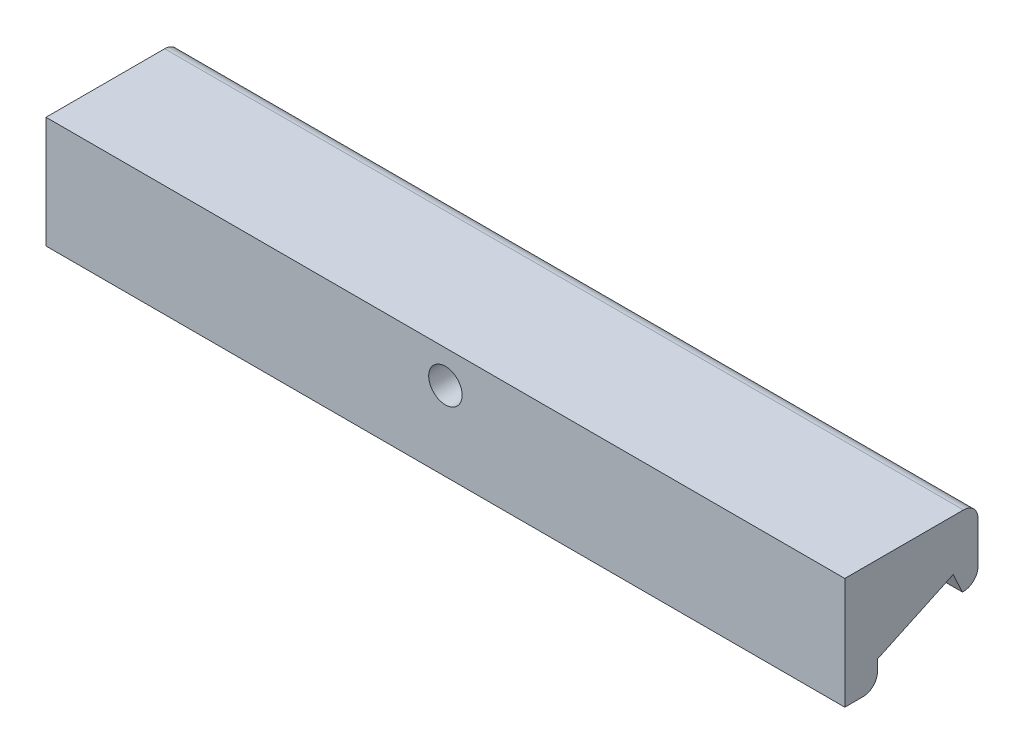
from build123d import *

# Parameters (mm, degrees)
PROFILEBOSS_EXTRUDE1_DEPTH      = 110
SKETCH3_R                       = 2.3
MOUNTINGHOLESCUT_EXTRUDE3_DEPTH = 4.5


with BuildPart() as part:
    # Sketch1 → ProfileBoss-Extrude1 (new body)
    with BuildSketch(Plane(origin=(0, 0, 0), x_dir=(0, 0, -1), z_dir=(1, 0, 0))):
        with BuildLine():
            Line((0, 0), (2.499461553, 0))
            ThreePointArc((2.499461553, 0), (3.914055855, 0.585944145), (4.5, 2.000538447))
            Line((4.5, 2.000538447), (4.5, 3.5))
            Line((4.5, 3.5), (14.922539551, 8.36011001))
            Line((14.922539551, 8.36011001), (16.190394336, 5.641186649))
            ThreePointArc((16.190394336, 5.641186649), (17.700753359, 6.16912635), (18.340729536, 7.635528477))
            Line((18.340729536, 7.635528477), (18.340729536, 13.36011001))
            ThreePointArc((18.340729536, 13.36011001), (17.754943098, 14.774323572), (16.340729536, 15.36011001))
            Line((16.340729536, 15.36011001), (0, 15.36011001))
            Line((0, 15.36011001), (0, 0))
        make_face()
    extrude(amount=PROFILEBOSS_EXTRUDE1_DEPTH)

    # Sketch3 → MountingHolesCut-Extrude3 (cut)
    with BuildSketch(Plane.XY):
        with Locations((55, 10.86011001)):
            Circle(SKETCH3_R)
    extrude(amount=-MOUNTINGHOLESCUT_EXTRUDE3_DEPTH, mode=Mode.SUBTRACT)


solid = part.part
